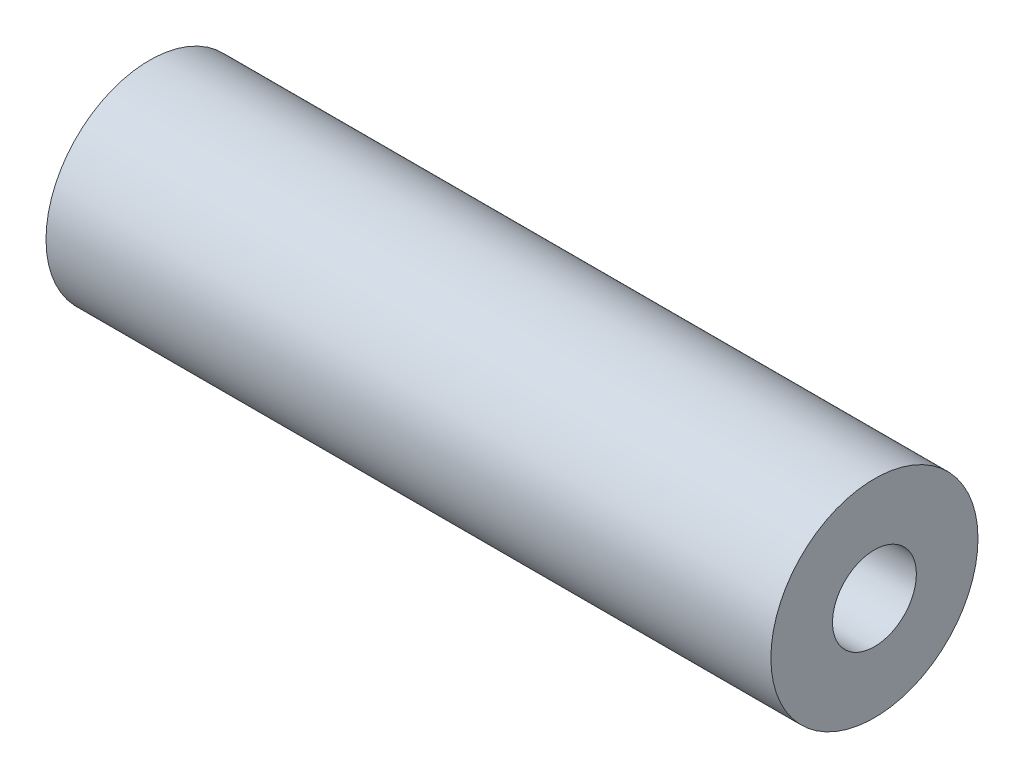
from build123d import *

# Parameters (mm, degrees)
SKETCH1_R           = 20
SKETCH1_R_2         = 8.1
BOSS_EXTRUDE1_DEPTH = 140


with BuildPart() as part:
    # Sketch1 → Boss-Extrude1 (new body)
    with BuildSketch(Plane(origin=(0, 0, 0), x_dir=(0, 0, -1), z_dir=(1, 0, 0))):
        Circle(SKETCH1_R)
        Circle(SKETCH1_R_2, mode=Mode.SUBTRACT)
    extrude(amount=BOSS_EXTRUDE1_DEPTH)


solid = part.part
